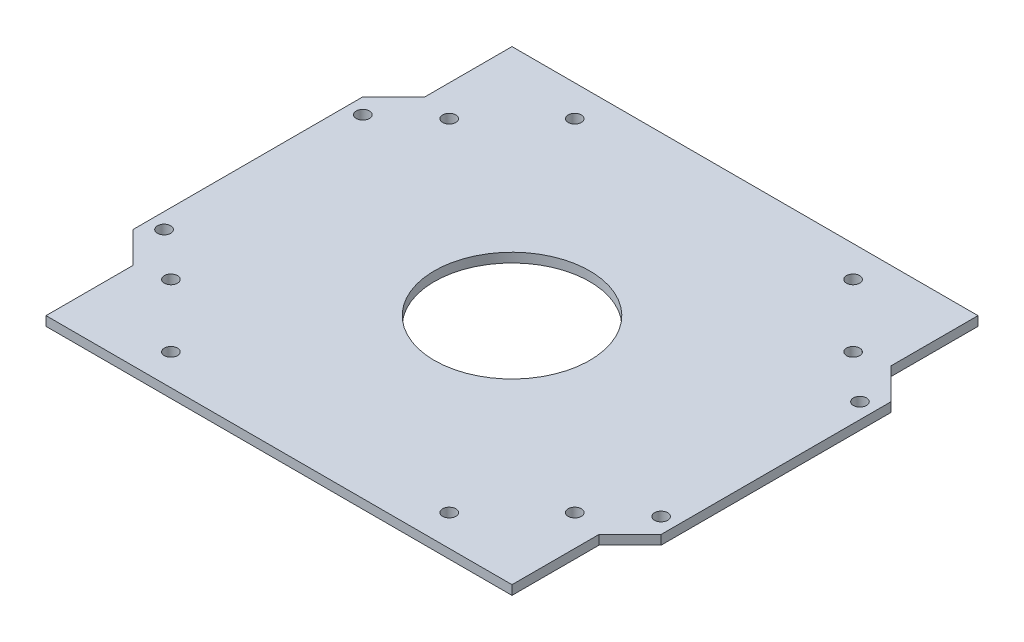
from build123d import *

# Parameters (mm, degrees)
SKETCH1_W           = 150
SKETCH1_H           = 150
BOSS_EXTRUDE1_DEPTH = 3
SKETCH2_R           = 2.125
SKETCH2_R_2         = 25
CUT_EXTRUDE3_DEPTH  = 107.108435103
SKETCH3_W           = 10
SKETCH3_H           = 74
SKETCH3_R           = 2.125
BOSS_EXTRUDE2_DEPTH = 3
BOSS_EXTRUDE3_DEPTH = 3


with BuildPart() as part:
    # Sketch1 → Boss-Extrude1 (new body)
    with BuildSketch(Plane(origin=(0, 0, 0), x_dir=(1, 0, 0), z_dir=(0, 1, 0))):
        Rectangle(SKETCH1_W, SKETCH1_H)
    extrude(amount=BOSS_EXTRUDE1_DEPTH)

    # Sketch2 → Cut-Extrude3 (cut, through all)
    with BuildSketch(Plane(origin=(0, 3, 0), x_dir=(1, 0, 0), z_dir=(0, 1, 0))):
        with Locations(Location((-65, -44.8, 0), (0, 0, 270))):
            Circle(SKETCH2_R)
        with Locations(Location((-65, 44.8, 0), (0, 0, 90))):
            Circle(SKETCH2_R)
        with Locations(Location((-44.8, 65, 0), (0, 0, 270))):
            Circle(SKETCH2_R)
        with Locations(Location((44.8, 65, 0), (0, 0, 90))):
            Circle(SKETCH2_R)
        with Locations(Location((65, 44.8, 0), (0, 0, 270))):
            Circle(SKETCH2_R)
        with Locations(Location((65, -44.8, 0), (0, 0, 90))):
            Circle(SKETCH2_R)
        with Locations(Location((44.8, -65, 0), (0, 0, 270))):
            Circle(SKETCH2_R)
        with Locations(Location((-44.8, -65, 0), (0, 0, 90))):
            Circle(SKETCH2_R)
        with Locations(Location((0, 0, 0), (0, 0, 270))):
            Circle(SKETCH2_R_2)
    extrude(amount=-CUT_EXTRUDE3_DEPTH, mode=Mode.SUBTRACT)

    # Sketch3 → Boss-Extrude2 (add)
    # profile 1 of 2: a face of its own
    with BuildSketch(Plane(origin=(0, 3, 0), x_dir=(1, 0, 0), z_dir=(0, 1, 0))):
        with Locations((-80, 0)):
            Rectangle(SKETCH3_W, SKETCH3_H)
        with Locations(Location((-80, 32, 0), (0, 0, 270))):
            Circle(SKETCH3_R, mode=Mode.SUBTRACT)
        with Locations(Location((-80, -32, 0), (0, 0, 90))):
            Circle(SKETCH3_R, mode=Mode.SUBTRACT)
    # profile 2 of 2: a face of its own
    with BuildSketch(Plane(origin=(0, 3, 0), x_dir=(1, 0, 0), z_dir=(0, 1, 0))):
        with Locations((80, 0)):
            Rectangle(SKETCH3_W, SKETCH3_H)
        with Locations(Location((80, -32, 0), (0, 0, 270))):
            Circle(SKETCH3_R, mode=Mode.SUBTRACT)
        with Locations(Location((80, 32, 0), (0, 0, 90))):
            Circle(SKETCH3_R, mode=Mode.SUBTRACT)
    extrude(amount=-BOSS_EXTRUDE2_DEPTH)

    # Sketch4 → Boss-Extrude3 (add)
    with BuildSketch(Plane(origin=(0, 3, 0), x_dir=(1, 0, 0), z_dir=(0, 1, 0))):
        Polygon((-85, 37), (-75, 47), (-75, 37), align=None)
        Polygon((75, 47), (75, 37), (85, 37), align=None)
        Polygon((85, -37), (75, -47), (75, -37), align=None)
        Polygon((-75, -47), (-75, -37), (-85, -37), align=None)
    extrude(amount=-BOSS_EXTRUDE3_DEPTH)


solid = part.part
